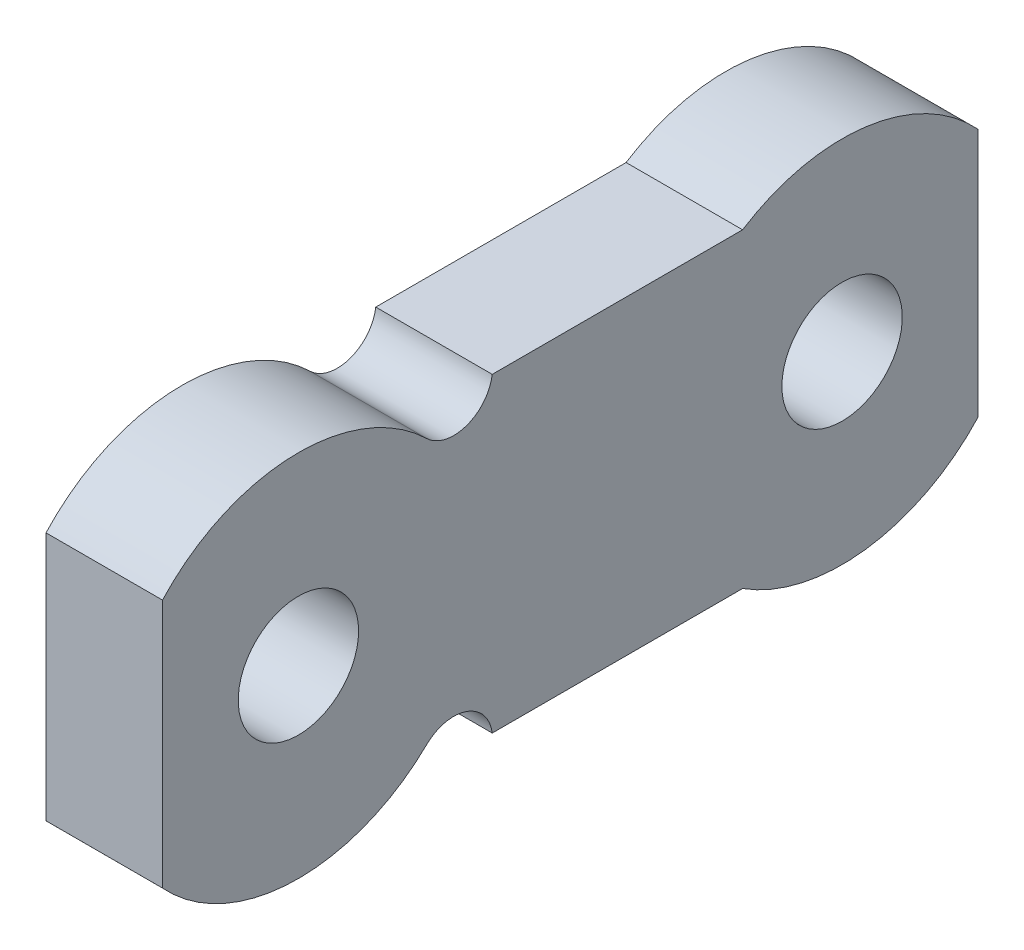
from build123d import *

# Parameters (mm, degrees)
SKETCH_1_R      = 1.55
EXTRUDE_1_DEPTH = 3


with BuildPart() as part:
    # 草图1 → 凸台-拉伸1 (new body)
    with BuildSketch(Plane(origin=(0, 0, 0), x_dir=(0, 0, -1), z_dir=(1, 0, 0))):
        with BuildLine():
            Line((-2.008575125, 4), (4.438262309, 4))
            ThreePointArc((4.438262309, 4), (7.612856223, 4.710298), (10.5, 3.211308145))
            Line((10.5, 3.211308145), (10.5, -3.211308145))
            ThreePointArc((10.5, -3.211308145), (7.612856223, -4.710298), (4.438262309, -4))
            Line((4.438262309, -4), (-2.008575125, -4))
            ThreePointArc((-2.008575125, -4), (-2.671034277, -3.186336048), (-3.695652174, -3.412299143))
            ThreePointArc((-3.695652174, -3.412299143), (-7.140247241, -4.747929097), (-10.5, -3.211308145))
            Line((-10.5, -3.211308145), (-10.5, 3.211308145))
            ThreePointArc((-10.5, 3.211308145), (-7.140247241, 4.747929097), (-3.695652174, 3.412299143))
            ThreePointArc((-3.695652174, 3.412299143), (-2.671034277, 3.186336048), (-2.008575125, 4))
        make_face()
        with Locations((-7, 0)):
            Circle(SKETCH_1_R, mode=Mode.SUBTRACT)
        with Locations(Location((7, 0, 0), (0, 0, 180))):
            Circle(SKETCH_1_R, mode=Mode.SUBTRACT)
    extrude(amount=EXTRUDE_1_DEPTH)


solid = part.part
